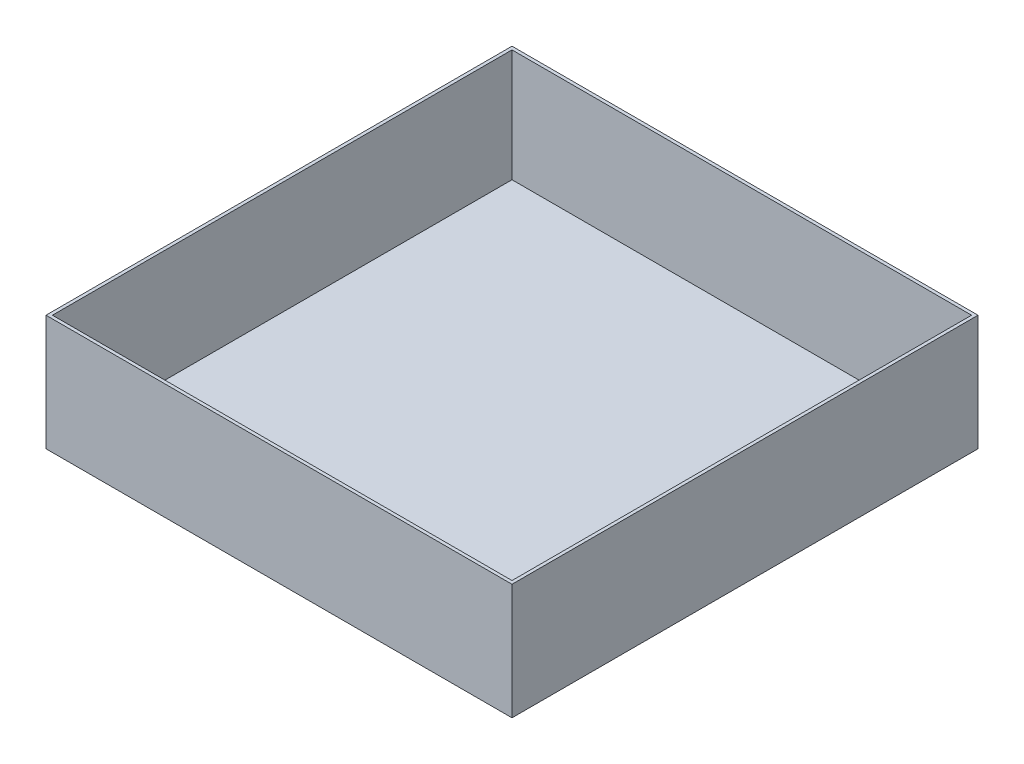
from build123d import *

# Parameters (mm, degrees)
SKETCH1_W           = 290
SKETCH1_H           = 290
SKETCH1_W_2         = 286
SKETCH1_H_2         = 286
BOSS_EXTRUDE1_DEPTH = 70
SKETCH5_W           = 290
SKETCH5_H           = 290
BOSS_EXTRUDE3_DEPTH = 2


with BuildPart() as part:
    # Sketch1 → Boss-Extrude1 (new body)
    with BuildSketch(Plane(origin=(0, 0, 0), x_dir=(1, 0, 0), z_dir=(0, 1, 0))):
        Rectangle(SKETCH1_W, SKETCH1_H)
        Rectangle(SKETCH1_W_2, SKETCH1_H_2, mode=Mode.SUBTRACT)
    extrude(amount=BOSS_EXTRUDE1_DEPTH)

    # Sketch5 → Boss-Extrude3 (add)
    with BuildSketch(Plane(origin=(0, 0, 0), x_dir=(-1, 0, 0), z_dir=(0, -1, 0))):
        Rectangle(SKETCH5_W, SKETCH5_H)
    extrude(amount=BOSS_EXTRUDE3_DEPTH)


solid = part.part
